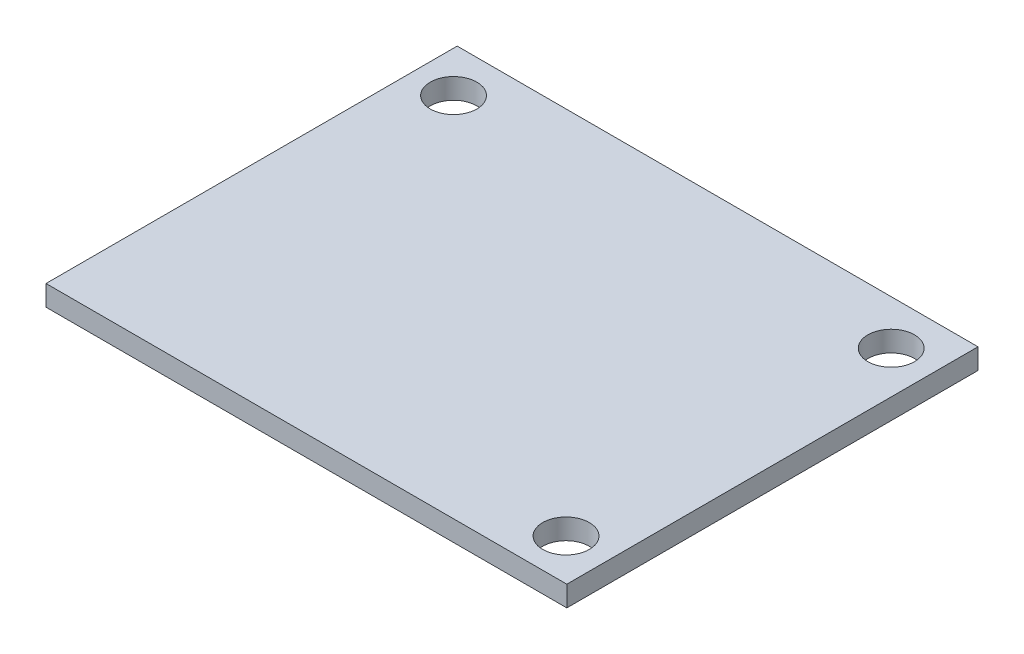
from build123d import *

# Parameters (mm, degrees)
SKETCH1_W           = 38
SKETCH1_H           = 30
BOSS_EXTRUDE1_DEPTH = 1.5
SKETCH2_R           = 1.7
CUT_EXTRUDE1_DEPTH  = 25.253865671


with BuildPart() as part:
    # Sketch1 → Boss-Extrude1 (new body)
    with BuildSketch(Plane(origin=(0, 0, 0), x_dir=(1, 0, 0), z_dir=(0, 1, 0))):
        Rectangle(SKETCH1_W, SKETCH1_H)
    extrude(amount=BOSS_EXTRUDE1_DEPTH)

    # Sketch2 → Cut-Extrude1 (cut, through all)
    with BuildSketch(Plane(origin=(0, 1.5, 0), x_dir=(1, 0, 0), z_dir=(0, 1, 0))):
        with Locations(Location((-16.006340174, 11.742024799, 0), (0, 0, 270))):
            Circle(SKETCH2_R)
        with Locations(Location((15.925500072, 11.742024799, 0), (0, 0, 270))):
            Circle(SKETCH2_R)
        with Locations(Location((15.925500072, -11.984545105, 0), (0, 0, 270))):
            Circle(SKETCH2_R)
    extrude(amount=-CUT_EXTRUDE1_DEPTH, mode=Mode.SUBTRACT)


solid = part.part
